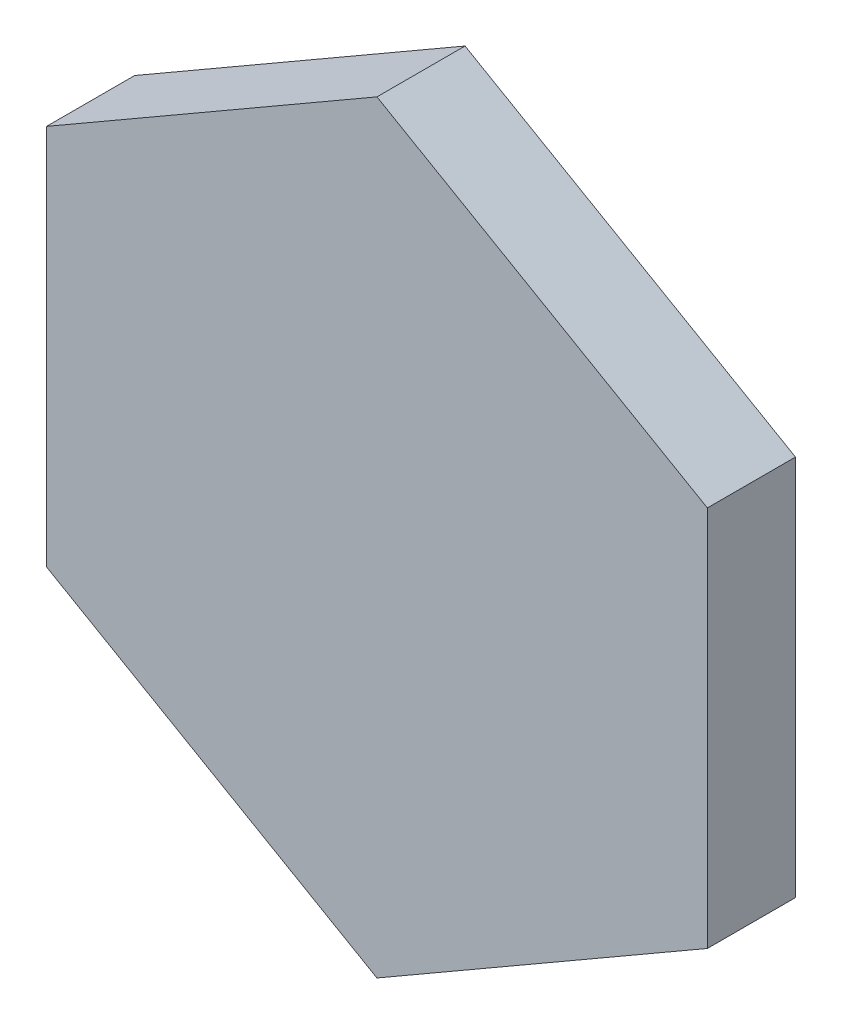
from build123d import *

# Parameters (mm, degrees)
BOSS_EXTRUDE1_DEPTH = 20


with BuildPart() as part:
    # Sketch1 → Boss-Extrude1 (new body)
    with BuildSketch(Plane.XY):
        Polygon((75, 43.301270189), (0, 86.602540378), (-75, 43.301270189), (-75, -43.301270189), (0, -86.602540378), (75, -43.301270189), align=None)
    extrude(amount=BOSS_EXTRUDE1_DEPTH)


solid = part.part
